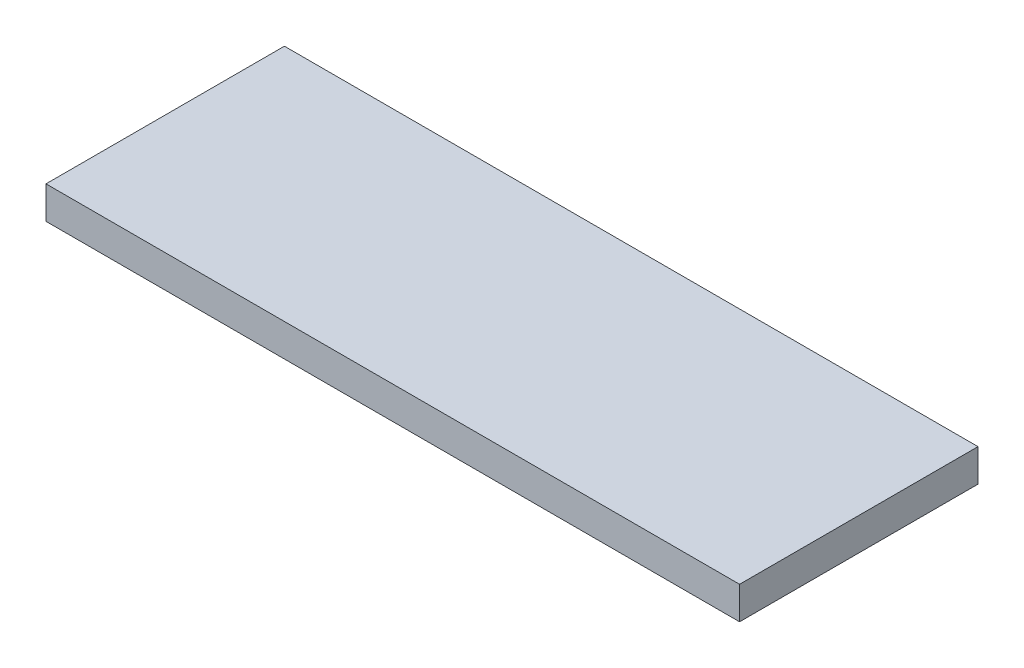
from build123d import *

# Parameters (mm, degrees)
SKETCH1_W           = 160
SKETCH1_H           = 55
BOSS_EXTRUDE1_DEPTH = 3.75
SKETCH2_W           = 14
SKETCH2_H           = 14
CUT_EXTRUDE1_DEPTH  = 3.5


with BuildPart() as part:
    # Sketch1 → Boss-Extrude1 (new, symmetric)
    with BuildSketch(Plane(origin=(0, 0, 0), x_dir=(1, 0, 0), z_dir=(0, 1, 0))):
        Rectangle(SKETCH1_W, SKETCH1_H)
    extrude(amount=BOSS_EXTRUDE1_DEPTH, both=True)

    # Sketch2 → Cut-Extrude1 (cut)
    with BuildSketch(Plane.XZ.offset(3.75)):
        with Locations((69.168154724, 17.5)):
            Rectangle(SKETCH2_W, SKETCH2_H)
        with Locations((69.168154724, -17.5)):
            Rectangle(SKETCH2_W, SKETCH2_H)
        Polygon((-41.168154724, -9.5), (-31.168154724, -9.5), (-31.168154724, -25.5), (-77.168154724, -25.5), (-77.168154724, 25.5), (-31.168154724, 25.5), (-31.168154724, 9.5), (-41.168154724, 9.5), align=None)
    extrude(amount=-CUT_EXTRUDE1_DEPTH, mode=Mode.SUBTRACT)


solid = part.part
